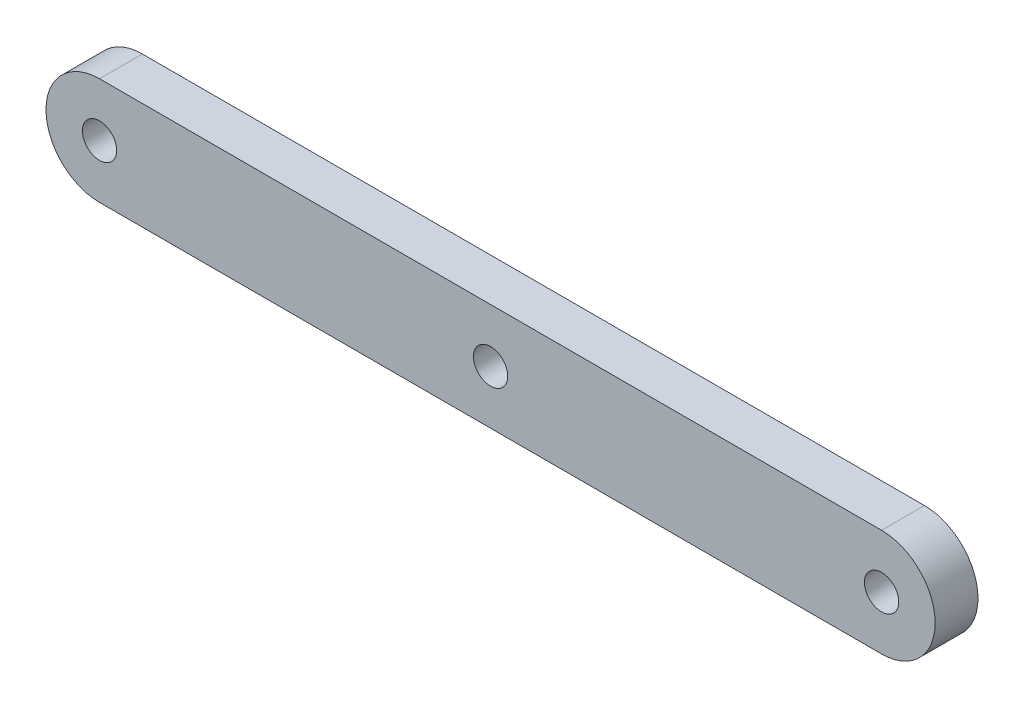
from build123d import *

# Parameters (mm, degrees)
SKETCH_2_R      = 1.6
EXTRUDE_2_DEPTH = 4


with BuildPart() as part:
    # 草图2 → 凸台-拉伸2 (new body)
    with BuildSketch(Plane.XY):
        with BuildLine():
            Line((-79.713388692, 33.720712468), (-6.713388692, 33.720712468))
            ThreePointArc((-6.713388692, 33.720712468), (-1.713388692, 28.720712468), (-6.713388692, 23.720712468))
            Line((-6.713388692, 23.720712468), (-79.713388692, 23.720712468))
            ThreePointArc((-79.713388692, 23.720712468), (-84.713388692, 28.720712468), (-79.713388692, 33.720712468))
        make_face()
        with Locations((-79.713388692, 28.720712468)):
            Circle(SKETCH_2_R, mode=Mode.SUBTRACT)
        with Locations((-6.713388692, 28.720712468)):
            Circle(SKETCH_2_R, mode=Mode.SUBTRACT)
        with Locations((-43.213388692, 28.720712468)):
            Circle(SKETCH_2_R, mode=Mode.SUBTRACT)
    extrude(amount=EXTRUDE_2_DEPTH)


solid = part.part
